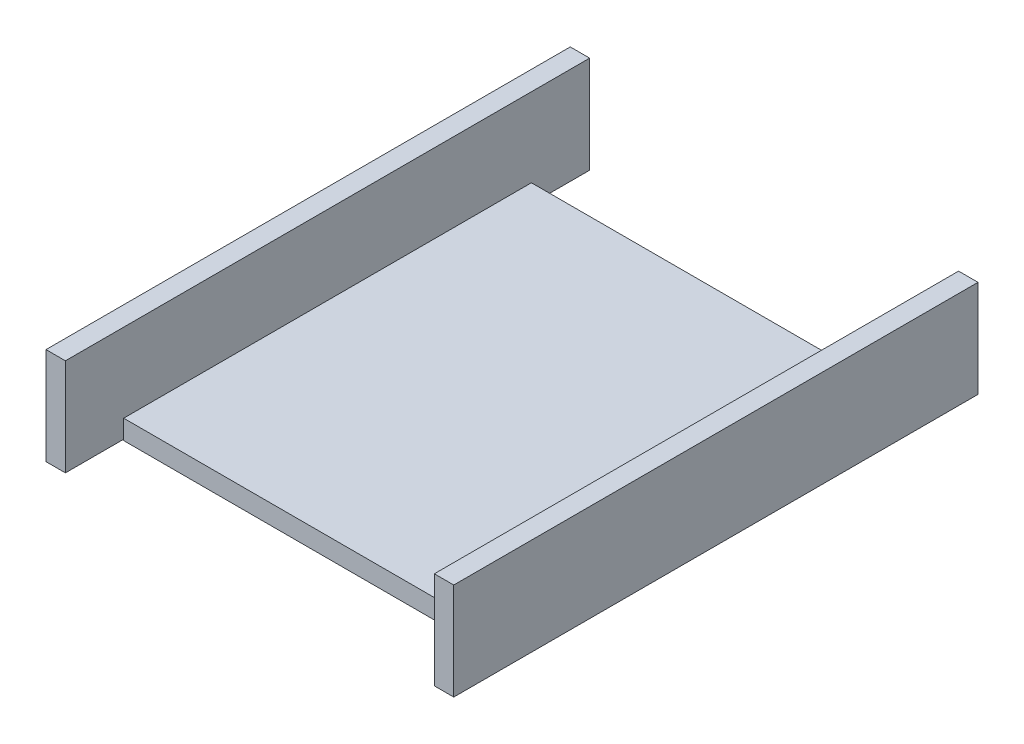
from build123d import *

# Parameters (mm, degrees)
SKETCH_1_W      = 135
SKETCH_1_H      = 25
EXTRUDE_1_DEPTH = 5
SKETCH_3_W      = 105
SKETCH_3_H      = 5
EXTRUDE_2_DEPTH = 95
SKETCH_4_W      = 135
SKETCH_4_H      = 25
EXTRUDE_3_DEPTH = 5


with BuildPart() as part:
    # 草图1 → 凸台-拉伸1 (new body)
    with BuildSketch(Plane(origin=(0, 0, 0), x_dir=(0, 0, -1), z_dir=(1, 0, 0))):
        Rectangle(SKETCH_1_W, SKETCH_1_H)
    extrude(amount=EXTRUDE_1_DEPTH)

    # 草图3 → 凸台-拉伸2 (add)
    with BuildSketch(Plane(origin=(5, 0, 0), x_dir=(0, 0, -1), z_dir=(1, 0, 0))):
        with Locations((0, -10.300870967)):
            Rectangle(SKETCH_3_W, SKETCH_3_H)
    extrude(amount=EXTRUDE_2_DEPTH)

    # 草图4 → 凸台-拉伸3 (add)
    with BuildSketch(Plane(origin=(100, 0, 0), x_dir=(0, 0, -1), z_dir=(1, 0, 0))):
        Rectangle(SKETCH_4_W, SKETCH_4_H)
    extrude(amount=EXTRUDE_3_DEPTH)


solid = part.part
